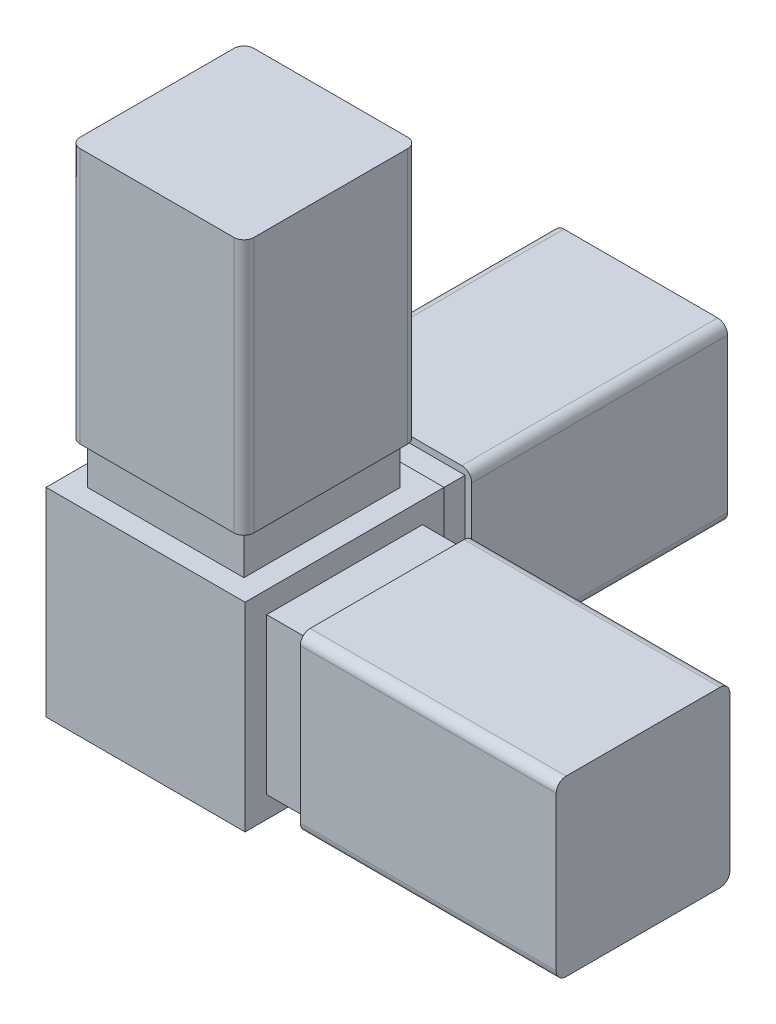
from build123d import *

# Parameters (mm, degrees)
SZKIC1_W                    = 20
SZKIC1_H                    = 20
DODANIE_WYCI_GNI_CIE1_DEPTH = 20
SZKIC2_W                    = 15.7
SZKIC2_H                    = 15.7
DODANIE_WYCI_GNI_CIE2_DEPTH = 4.28
SZKIC3_W                    = 15.662415204
SZKIC3_H                    = 15.662415203
DODANIE_WYCI_GNI_CIE3_DEPTH = 4.28
SZKIC4_W                    = 15.662415203
SZKIC4_H                    = 15.662415203
DODANIE_WYCI_GNI_CIE4_DEPTH = 4.28
SZKIC5_W                    = 17.455323011
SZKIC5_H                    = 17.455323012
DODANIE_WYCI_GNI_CIE5_DEPTH = 25.72
SZKIC6_W                    = 17.458466428
SZKIC6_H                    = 17.458466428
DODANIE_WYCI_GNI_CIE6_DEPTH = 25.72
SZKIC7_W                    = 17.458466427
SZKIC7_H                    = 17.458466428
DODANIE_WYCI_GNI_CIE7_DEPTH = 25.72
ZAOKR_GLENIE2_R             = 1


with BuildPart() as part:
    # Szkic1 → Dodanie-wyciągnięcie1 (new body)
    with BuildSketch(Plane.XY):
        with Locations((-3.917212592, 19.226146443)):
            Rectangle(SZKIC1_W, SZKIC1_H)
    extrude(amount=DODANIE_WYCI_GNI_CIE1_DEPTH)

    # Szkic2 → Dodanie-wyciągnięcie2 (add)
    with BuildSketch(Plane(origin=(0, 29.226146443, 0), x_dir=(1, 0, 0), z_dir=(0, 1, 0))):
        with Locations((-3.957055084, -10.078566334)):
            Rectangle(SZKIC2_W, SZKIC2_H)
    extrude(amount=DODANIE_WYCI_GNI_CIE2_DEPTH)

    # Szkic3 → Dodanie-wyciągnięcie3 (add)
    with BuildSketch(Plane(origin=(6.082787408, 0, 0), x_dir=(0, 0, -1), z_dir=(1, 0, 0))):
        with Locations((-10, 19.226146442)):
            Rectangle(SZKIC3_W, SZKIC3_H)
    extrude(amount=DODANIE_WYCI_GNI_CIE3_DEPTH)

    # Szkic4 → Dodanie-wyciągnięcie4 (add)
    with BuildSketch(Plane(origin=(0, 0, 0), x_dir=(-1, 0, 0), z_dir=(0, 0, -1))):
        with Locations((3.917212592, 19.226146442)):
            Rectangle(SZKIC4_W, SZKIC4_H)
    extrude(amount=DODANIE_WYCI_GNI_CIE4_DEPTH)

    # Szkic5 → Dodanie-wyciągnięcie5 (add)
    with BuildSketch(Plane(origin=(0, 0, -4.28), x_dir=(-1, 0, 0), z_dir=(0, 0, -1))):
        with Locations((4.144874098, 18.998484937)):
            Rectangle(SZKIC5_W, SZKIC5_H)
    extrude(amount=DODANIE_WYCI_GNI_CIE5_DEPTH)

    # Szkic6 → Dodanie-wyciągnięcie6 (add)
    with BuildSketch(Plane(origin=(10.362787408, 0, 0), x_dir=(0, 0, -1), z_dir=(1, 0, 0))):
        with Locations((-10, 19.226146443)):
            Rectangle(SZKIC6_W, SZKIC6_H)
    extrude(amount=DODANIE_WYCI_GNI_CIE6_DEPTH)

    # Szkic7 → Dodanie-wyciągnięcie7 (add)
    with BuildSketch(Plane(origin=(0, 33.506146443, 0), x_dir=(1, 0, 0), z_dir=(0, 1, 0))):
        with Locations((-3.957055085, -10.078566334)):
            Rectangle(SZKIC7_W, SZKIC7_H)
    extrude(amount=DODANIE_WYCI_GNI_CIE7_DEPTH)

    # Zaokrąglenie2
    zaokr_glenie2_edges = [part.edges().sort_by_distance(p)[0] for p in [
        (4.582787408, 27.726146443, -17.14),
        (4.582787408, 10.270823431, -17.14),
        (-12.872535603, 10.270823431, -17.14),
        (-12.872535603, 27.726146443, -17.14),
        (23.222787408, 10.496913229, 18.729233214),
        (23.222787408, 10.496913229, 1.270766786),
        (23.222787408, 27.955379657, 1.270766786),
        (23.222787408, 27.955379657, 18.729233214),
        (4.772178129, 46.366146443, 18.807799548),
        (4.772178129, 46.366146443, 1.34933312),
        (-12.686288298, 46.366146443, 1.34933312),
        (-12.686288298, 46.366146443, 18.807799548),
    ]]
    fillet(zaokr_glenie2_edges, radius=ZAOKR_GLENIE2_R)


solid = part.part
